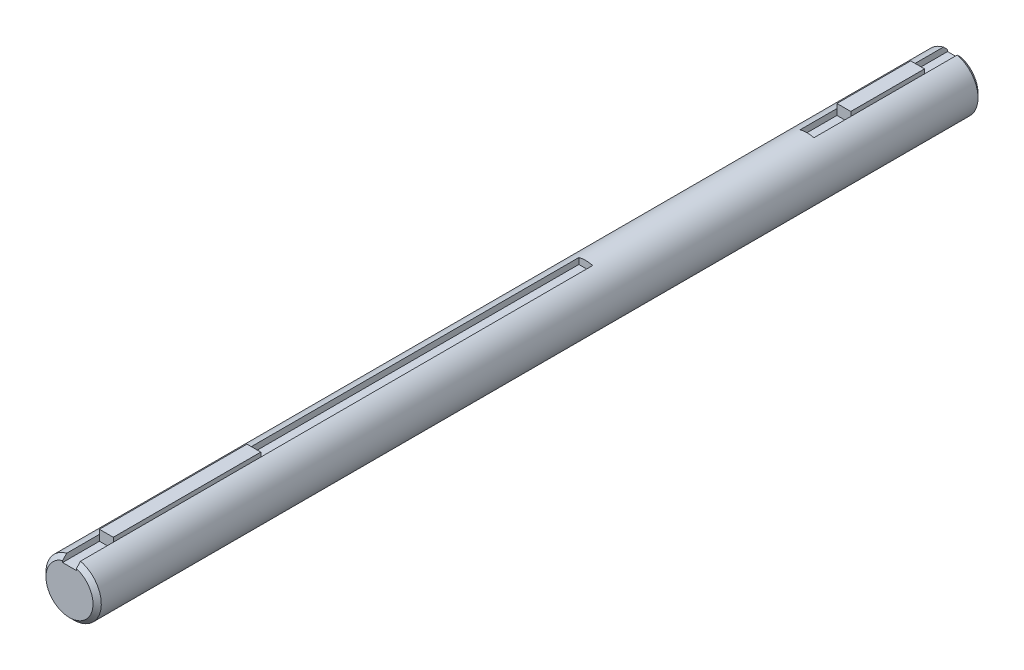
from build123d import *

# Parameters (mm, degrees)
SKETCH1_R           = 19.05
EXTRUDE1_DEPTH      = 304.8
CHAMFER1_SIZE       = 2.8575
EXTRUDE2_DEPTH      = 306.9883086
EXTRUDE2_DEPTH_BACK = 306.9883086
SKETCH3_W           = 9.525
SKETCH3_H           = 4.7625
EXTRUDE3_START      = -203.2
SKETCH1_2_R         = 19.05
EXTRUDE3_DEPTH      = 152.4
SKETCH5_W           = 9.525
SKETCH5_H           = 7.14375
EXTRUDE4_DEPTH      = 50.8
SKETCH6_W           = 9.525
SKETCH6_H           = 7.14375
EXTRUDE5_DEPTH      = 25.4


with BuildPart() as part:
    # Sketch1 → Extrude1 (new, symmetric)
    with BuildSketch(Plane.XY):
        with Locations(Location((0, 0, 0), (0, 0, 180))):
            Circle(SKETCH1_R)
    extrude(amount=EXTRUDE1_DEPTH, both=True)

    # Chamfer1
    chamfer1_edges = [part.edges().sort_by_distance(p)[0] for p in [
        (19.05, 0, -304.8),
        (19.05, 0, 304.8),
    ]]
    chamfer(chamfer1_edges, length=CHAMFER1_SIZE)

    # Sketch3 → Extrude2 (cut, two sides: drawn at the far end of the back side and taken through both)
    with BuildSketch(Plane.XY.offset(-EXTRUDE2_DEPTH_BACK)):
        with Locations((0, 16.66875)):
            Rectangle(SKETCH3_W, SKETCH3_H)
    extrude(amount=EXTRUDE2_DEPTH + EXTRUDE2_DEPTH_BACK, mode=Mode.SUBTRACT)

    # Sketch1<2> → Extrude3 (add)
    with BuildSketch(Plane.XY.offset(EXTRUDE3_START)):
        with Locations(Location((0, 0, 0), (0, 0, 104.477512186))):
            Circle(SKETCH1_2_R)
    extrude(amount=EXTRUDE3_DEPTH)


with BuildPart() as body_2:
    # Sketch5 → Extrude4 (new, symmetric)
    with BuildSketch(Plane.XY.offset(228.6)):
        with Locations((0, 17.859375)):
            Rectangle(SKETCH5_W, SKETCH5_H)
    extrude(amount=EXTRUDE4_DEPTH, both=True)


with BuildPart() as body_3:
    # Sketch6 → Extrude5 (new, symmetric)
    with BuildSketch(Plane(origin=(0, 0, -254), x_dir=(-1, 0, 0), z_dir=(0, 0, -1))):
        with Locations((0, 17.859375)):
            Rectangle(SKETCH6_W, SKETCH6_H)
    extrude(amount=EXTRUDE5_DEPTH, both=True)


solid = Compound([part.part, body_2.part, body_3.part])
